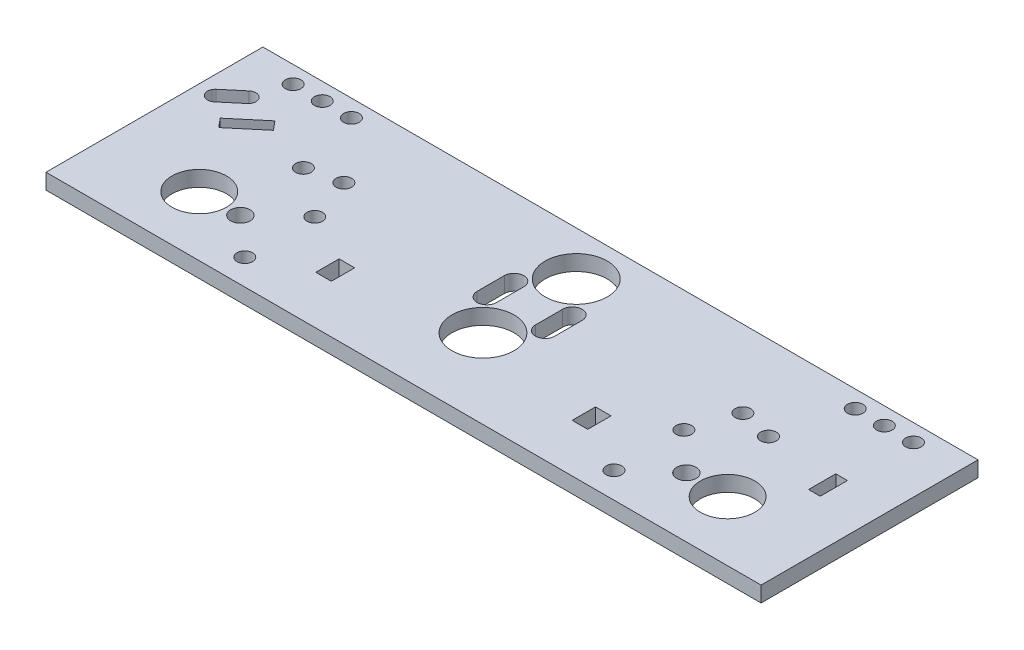
from build123d import *

# Parameters (mm, degrees)
SKETCH1_W           = 184.061364714
SKETCH1_H           = 55.833983991
SKETCH1_R           = 8
SKETCH1_R_2         = 2.5
SKETCH1_R_3         = 2
SKETCH1_R_4         = 7
SKETCH1_W_2         = 4
SKETCH1_H_2         = 6
SKETCH1_W_3         = 3
SKETCH1_H_3         = 7
BOSS_EXTRUDE1_DEPTH = 4


with BuildPart() as part:
    # Sketch1 → Boss-Extrude1 (new body)
    with BuildSketch(Plane(origin=(0, 0, 0), x_dir=(1, 0, 0), z_dir=(0, 1, 0))):
        with Locations((0, 7.472529138)):
            Rectangle(SKETCH1_W, SKETCH1_H)
        with Locations(Location((0, 24, 0), (0, 0, 270))):
            Circle(SKETCH1_R, mode=Mode.SUBTRACT)
        with Locations(Location((0, 0, 0), (0, 0, 270))):
            Circle(SKETCH1_R, mode=Mode.SUBTRACT)
        with Locations(Location((-57.4, -5.031515304, 0), (0, 0, 270))):
            Circle(SKETCH1_R_2, mode=Mode.SUBTRACT)
        with Locations(Location((-47.507878323, -13.796629956, 0), (0, 0, 270))):
            Circle(SKETCH1_R_3, mode=Mode.SUBTRACT)
        with Locations(Location((-47.507878323, 4.203370044, 0), (0, 0, 270))):
            Circle(SKETCH1_R_3, mode=Mode.SUBTRACT)
        with Locations(Location((-59.862251394, 13.632128132, 0), (0, 0, 270))):
            Circle(SKETCH1_R_3, mode=Mode.SUBTRACT)
        with Locations(Location((-64.841917038, 30.968484696, 0), (0, 0, 270))):
            Circle(SKETCH1_R_3, mode=Mode.SUBTRACT)
        with Locations(Location((-72.341917038, 30.968484696, 0), (0, 0, 270))):
            Circle(SKETCH1_R_3, mode=Mode.SUBTRACT)
        with Locations(Location((-79.841917038, 30.968484696, 0), (0, 0, 270))):
            Circle(SKETCH1_R_3, mode=Mode.SUBTRACT)
        with Locations(Location((-68, -5.031515304, 0), (0, 0, 270))):
            Circle(SKETCH1_R_4, mode=Mode.SUBTRACT)
        with Locations(Location((-51.349592133, 15.545742715, 0), (0, 0, 270))):
            Circle(SKETCH1_R_3, mode=Mode.SUBTRACT)
        with Locations(Location((51.349592133, 15.545742715, 0), (0, 0, 90))):
            Circle(SKETCH1_R_3, mode=Mode.SUBTRACT)
        with Locations(Location((68, -5.031515304, 0), (0, 0, 90))):
            Circle(SKETCH1_R_4, mode=Mode.SUBTRACT)
        with Locations(Location((79.841917038, 30.968484696, 0), (0, 0, 90))):
            Circle(SKETCH1_R_3, mode=Mode.SUBTRACT)
        with Locations(Location((72.341917038, 30.968484696, 0), (0, 0, 90))):
            Circle(SKETCH1_R_3, mode=Mode.SUBTRACT)
        with Locations(Location((64.841917038, 30.968484696, 0), (0, 0, 90))):
            Circle(SKETCH1_R_3, mode=Mode.SUBTRACT)
        with Locations(Location((59.862251394, 13.632128132, 0), (0, 0, 90))):
            Circle(SKETCH1_R_3, mode=Mode.SUBTRACT)
        with Locations(Location((47.507878323, 4.203370044, 0), (0, 0, 90))):
            Circle(SKETCH1_R_3, mode=Mode.SUBTRACT)
        with Locations(Location((47.507878323, -13.796629956, 0), (0, 0, 90))):
            Circle(SKETCH1_R_3, mode=Mode.SUBTRACT)
        with Locations(Location((57.4, -5.031515304, 0), (0, 0, 90))):
            Circle(SKETCH1_R_2, mode=Mode.SUBTRACT)
        with BuildLine():
            Line((-5, 15.5), (-5, 8.5))
            ThreePointArc((-5, 8.5), (-7.5, 6), (-10, 8.5))
            Line((-10, 8.5), (-10, 15.5))
            ThreePointArc((-10, 15.5), (-7.5, 18), (-5, 15.5))
        make_face(mode=Mode.SUBTRACT)
        with Locations((-33, -5.031515304)):
            Rectangle(SKETCH1_W_2, SKETCH1_H_2, mode=Mode.SUBTRACT)
        with BuildLine():
            Line((5, 15.5), (5, 8.5))
            ThreePointArc((5, 8.5), (7.5, 6), (10, 8.5))
            Line((10, 8.5), (10, 15.5))
            ThreePointArc((10, 15.5), (7.5, 18), (5, 15.5))
        make_face(mode=Mode.SUBTRACT)
        with Locations((33, -5.031515304)):
            Rectangle(SKETCH1_W_2, SKETCH1_H_2, mode=Mode.SUBTRACT)
        with Locations((78.341917038, 10.468484696)):
            Rectangle(SKETCH1_W_3, SKETCH1_H_3, mode=Mode.SUBTRACT)
        Polygon((-72.090338009, 18.166660574), (-74.018700838, 20.464793903), (-81.679145269, 14.036917806), (-79.75078244, 11.738784477), align=None, mode=Mode.SUBTRACT)
        with BuildLine():
            Line((-88.619268655, 19.962128437), (-84.023001996, 23.818854095))
            ThreePointArc((-84.023001996, 23.818854095), (-81.20533789, 23.572340428), (-81.451851557, 20.754676323))
            Line((-81.451851557, 20.754676323), (-86.048118216, 16.897950664))
            ThreePointArc((-86.048118216, 16.897950664), (-88.865782322, 17.144464331), (-88.619268655, 19.962128437))
        make_face(mode=Mode.SUBTRACT)
    extrude(amount=BOSS_EXTRUDE1_DEPTH)


solid = part.part
